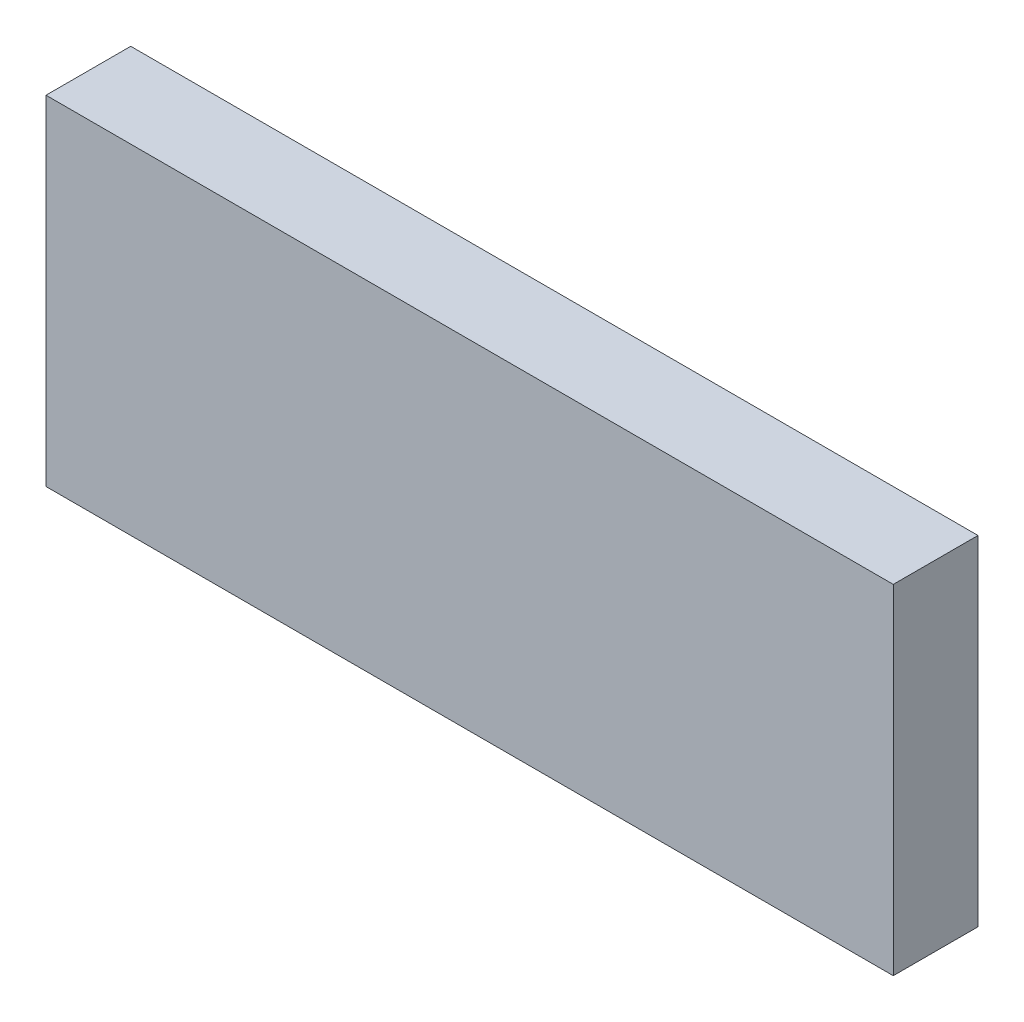
from build123d import *

# Parameters (mm, degrees)
ESQUISSE1_W          = 100
ESQUISSE1_H          = 40
BASE_EXTRUSION_DEPTH = 10


with BuildPart() as part:
    # Esquisse1 → Base-Extrusion (new body)
    with BuildSketch(Plane.XY):
        with Locations((91, -16.461316052)):
            Rectangle(ESQUISSE1_W, ESQUISSE1_H)
    extrude(amount=BASE_EXTRUSION_DEPTH)


solid = part.part
